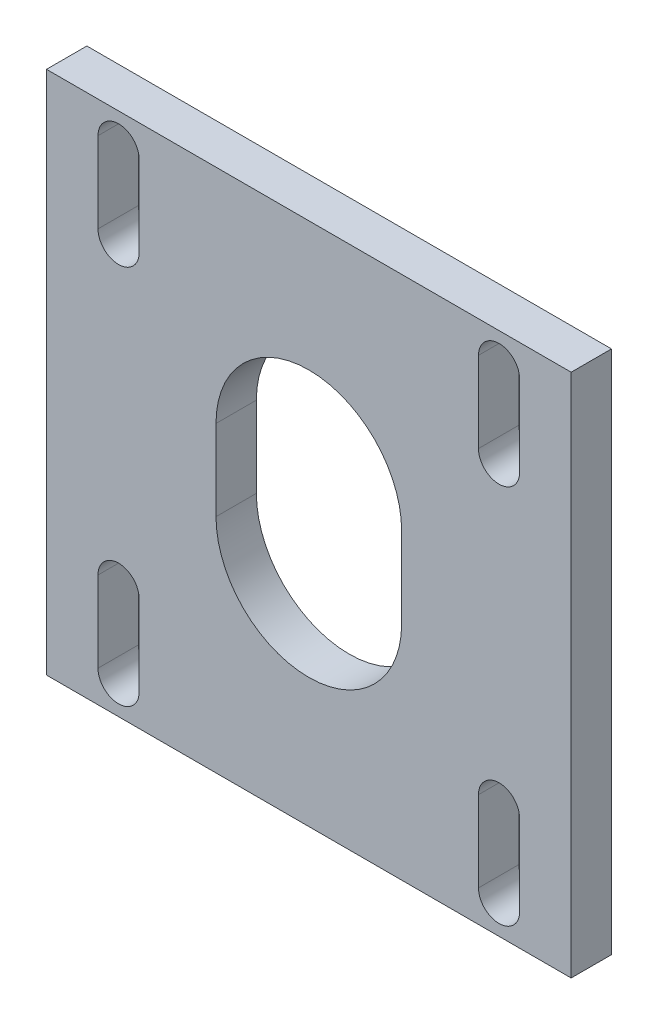
from build123d import *

# Parameters (mm, degrees)
SKETCH1_W           = 65
SKETCH1_H           = 65
BOSS_EXTRUDE1_DEPTH = 5
CUT_EXTRUDE2_REACH  = 94.06


with BuildPart() as part:
    # Sketch1 → Boss-Extrude1 (new body)
    with BuildSketch(Plane.XY):
        with Locations((32.5, -32.5)):
            Rectangle(SKETCH1_W, SKETCH1_H)
        with BuildLine():
            Line((11.48, -3.93), (11.48, -13.93))
            ThreePointArc((11.48, -13.93), (8.93, -16.48), (6.38, -13.93))
            Line((6.38, -13.93), (6.38, -3.93))
            ThreePointArc((6.38, -3.93), (8.93, -1.38), (11.48, -3.93))
        make_face(mode=Mode.SUBTRACT)
        with BuildLine():
            Line((53.52, -3.93), (53.52, -13.93))
            ThreePointArc((53.52, -13.93), (56.07, -16.48), (58.62, -13.93))
            Line((58.62, -13.93), (58.62, -3.93))
            ThreePointArc((58.62, -3.93), (56.07, -1.38), (53.52, -3.93))
        make_face(mode=Mode.SUBTRACT)
        with BuildLine():
            Line((11.48, -61.07), (11.48, -51.07))
            ThreePointArc((11.48, -51.07), (8.93, -48.52), (6.38, -51.07))
            Line((6.38, -51.07), (6.38, -61.07))
            ThreePointArc((6.38, -61.07), (8.93, -63.62), (11.48, -61.07))
        make_face(mode=Mode.SUBTRACT)
        with BuildLine():
            Line((53.52, -61.07), (53.52, -51.07))
            ThreePointArc((53.52, -51.07), (56.07, -48.52), (58.62, -51.07))
            Line((58.62, -51.07), (58.62, -61.07))
            ThreePointArc((58.62, -61.07), (56.07, -63.62), (53.52, -61.07))
        make_face(mode=Mode.SUBTRACT)
    extrude(amount=BOSS_EXTRUDE1_DEPTH)

    # Sketch2 → Cut-Extrude2 (cut, up to next)
    with BuildSketch(Plane.XY.offset(5), mode=Mode.PRIVATE) as cut_extrude2_sk1:
        with BuildLine():
            Line((44, -27.5), (44, -37.5))
            ThreePointArc((44, -37.5), (32.5, -49), (21, -37.5))
            Line((21, -37.5), (21, -27.5))
            ThreePointArc((21, -27.5), (32.5, -16), (44, -27.5))
        make_face()
    cut_extrude2_tool1 = extrude(cut_extrude2_sk1.sketch, amount=-CUT_EXTRUDE2_REACH, mode=Mode.PRIVATE) & part.part
    add(cut_extrude2_tool1.solids().sort_by_distance((32.5, -32.5, 5))[0], mode=Mode.SUBTRACT)


solid = part.part
